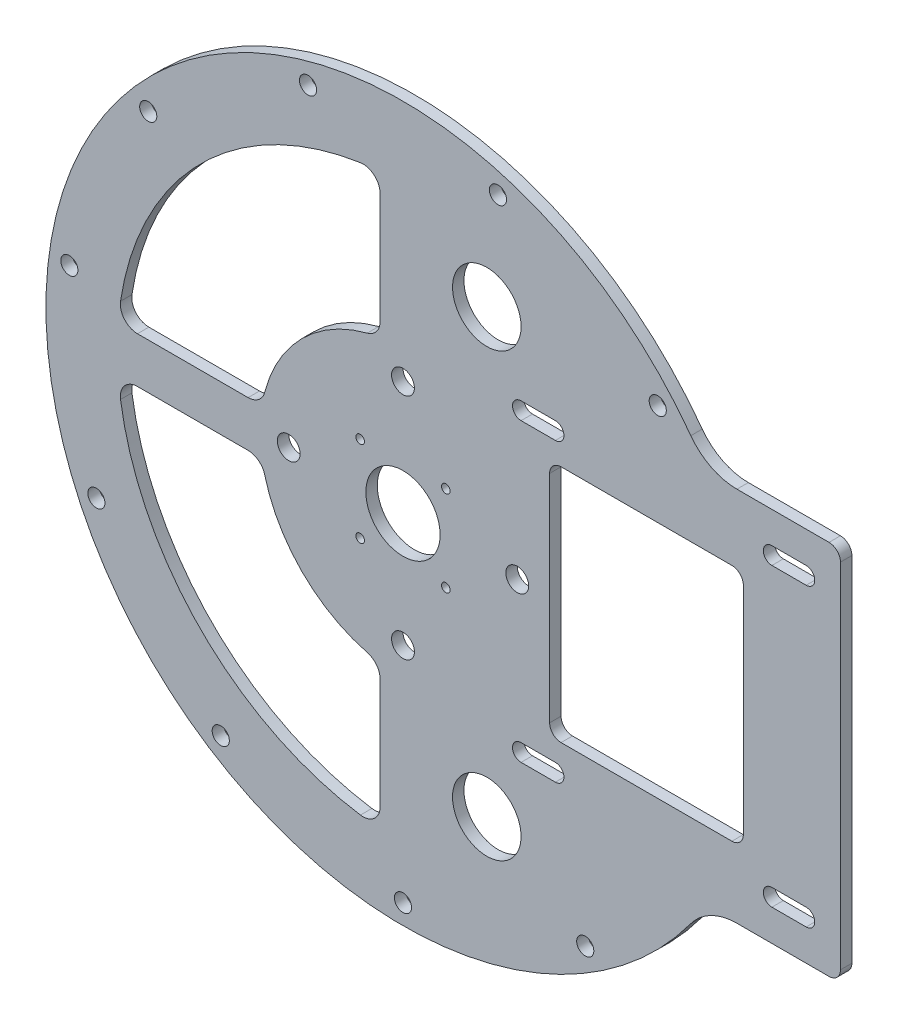
from build123d import *

# Parameters (mm, degrees)
SKETCH_1_R      = 2
SKETCH_1_R_2    = 1.5
SKETCH_1_R_3    = 6.5
SKETCH_1_R_4    = 0.75
SKETCH_1_R_5    = 6
EXTRUDE_1_DEPTH = 2


with BuildPart() as part:
    # 草图1 → 凸台-拉伸1 (new body)
    with BuildSketch(Plane.XY):
        with BuildLine():
            Line((58.445187997, 32.9), (74.5685, 32.9))
            ThreePointArc((74.5685, 32.9), (75.982713562, 32.314213562), (76.5685, 30.9))
            Line((76.5685, 30.9), (76.5685, -30.9))
            ThreePointArc((76.5685, -30.9), (75.982713562, -32.314213562), (74.5685, -32.9))
            Line((74.5685, -32.9), (58.445187997, -32.9))
            ThreePointArc((58.445187997, -32.9), (53.927025417, -33.978889817), (50.383782756, -36.982758621))
            ThreePointArc((50.383782756, -36.982758621), (-62.5, 0), (50.383782756, 36.982758621))
            ThreePointArc((50.383782756, 36.982758621), (53.927025417, 33.978889817), (58.445187997, 32.9))
        make_face()
        with Locations((0, -20)):
            Circle(SKETCH_1_R, mode=Mode.SUBTRACT)
        with Locations((0, -59)):
            Circle(SKETCH_1_R_2, mode=Mode.SUBTRACT)
        with Locations((-20, 0)):
            Circle(SKETCH_1_R, mode=Mode.SUBTRACT)
        with Locations((0, 20)):
            Circle(SKETCH_1_R, mode=Mode.SUBTRACT)
        with Locations((20, 0)):
            Circle(SKETCH_1_R, mode=Mode.SUBTRACT)
        with Locations((-31.89780823, -49.633958437)):
            Circle(SKETCH_1_R_2, mode=Mode.SUBTRACT)
        with Locations((-53.668287726, -24.509485767)):
            Circle(SKETCH_1_R_2, mode=Mode.SUBTRACT)
        with Locations((-58.399465071, 8.396575458)):
            Circle(SKETCH_1_R_2, mode=Mode.SUBTRACT)
        with Locations((-44.589224887, 38.636783303)):
            Circle(SKETCH_1_R_2, mode=Mode.SUBTRACT)
        with Locations((-16.622220854, 56.610085443)):
            Circle(SKETCH_1_R_2, mode=Mode.SUBTRACT)
        with Locations((16.622220854, 56.610085443)):
            Circle(SKETCH_1_R_2, mode=Mode.SUBTRACT)
        with Locations((44.589224887, 38.636783303)):
            Circle(SKETCH_1_R_2, mode=Mode.SUBTRACT)
        with Locations((31.89780823, -49.633958437)):
            Circle(SKETCH_1_R_2, mode=Mode.SUBTRACT)
        Circle(SKETCH_1_R_3, mode=Mode.SUBTRACT)
        with Locations((-7.498513861, -7.498513861)):
            Circle(SKETCH_1_R_4, mode=Mode.SUBTRACT)
        with Locations((-7.498513861, 7.498513861)):
            Circle(SKETCH_1_R_4, mode=Mode.SUBTRACT)
        with Locations((7.498513861, 7.498513861)):
            Circle(SKETCH_1_R_4, mode=Mode.SUBTRACT)
        with Locations((7.498513861, -7.498513861)):
            Circle(SKETCH_1_R_4, mode=Mode.SUBTRACT)
        with Locations((14.6685, 38.636783303)):
            Circle(SKETCH_1_R_5, mode=Mode.SUBTRACT)
        with Locations(Location((14.6685, -38.636783303, 0), (0, 0, 180))):
            Circle(SKETCH_1_R_5, mode=Mode.SUBTRACT)
        with BuildLine():
            Line((-46.475800154, 4), (-27.110883423, 4))
            ThreePointArc((-27.110883423, 4), (-25.273766116, 4.628291755), (-24.206145914, 6.25))
            ThreePointArc((-24.206145914, 6.25), (-17.67766953, 17.67766953), (-6.25, 24.206145914))
            ThreePointArc((-6.25, 24.206145914), (-4.628291755, 25.273766116), (-4, 27.110883423))
            Line((-4, 27.110883423), (-4, 46.475800154))
            ThreePointArc((-4, 46.475800154), (-5.043015781, 48.749610341), (-7.446808511, 49.44234059))
            ThreePointArc((-7.446808511, 49.44234059), (-35.355339059, 35.355339059), (-49.44234059, 7.446808511))
            ThreePointArc((-49.44234059, 7.446808511), (-48.749610341, 5.043015781), (-46.475800154, 4))
        make_face(mode=Mode.SUBTRACT)
        with BuildLine():
            Line((-27.110883423, -4), (-46.475800154, -4))
            ThreePointArc((-46.475800154, -4), (-48.749610341, -5.043015781), (-49.44234059, -7.446808511))
            ThreePointArc((-49.44234059, -7.446808511), (-35.355339059, -35.355339059), (-7.446808511, -49.44234059))
            ThreePointArc((-7.446808511, -49.44234059), (-5.043015781, -48.749610341), (-4, -46.475800154))
            Line((-4, -46.475800154), (-4, -27.110883423))
            ThreePointArc((-4, -27.110883423), (-4.628291755, -25.273766116), (-6.25, -24.206145914))
            ThreePointArc((-6.25, -24.206145914), (-17.67766953, -17.67766953), (-24.206145914, -6.25))
            ThreePointArc((-24.206145914, -6.25), (-25.273766116, -4.628291755), (-27.110883423, -4))
        make_face(mode=Mode.SUBTRACT)
        with BuildLine():
            Line((20.6685, -24.4), (26.6685, -24.4))
            ThreePointArc((26.6685, -24.4), (28.1685, -25.9), (26.6685, -27.4))
            Line((26.6685, -27.4), (20.6685, -27.4))
            ThreePointArc((20.6685, -27.4), (19.1685, -25.9), (20.6685, -24.4))
        make_face(mode=Mode.SUBTRACT)
        with BuildLine():
            Line((20.6685, 27.4), (26.6685, 27.4))
            ThreePointArc((26.6685, 27.4), (28.1685, 25.9), (26.6685, 24.4))
            Line((26.6685, 24.4), (20.6685, 24.4))
            ThreePointArc((20.6685, 24.4), (19.1685, 25.9), (20.6685, 27.4))
        make_face(mode=Mode.SUBTRACT)
        with BuildLine():
            Line((64.5685, 27.4), (70.5685, 27.4))
            ThreePointArc((70.5685, 27.4), (72.0685, 25.9), (70.5685, 24.4))
            Line((70.5685, 24.4), (64.5685, 24.4))
            ThreePointArc((64.5685, 24.4), (63.0685, 25.9), (64.5685, 27.4))
        make_face(mode=Mode.SUBTRACT)
        with BuildLine():
            Line((64.5685, -24.4), (70.5685, -24.4))
            ThreePointArc((70.5685, -24.4), (72.0685, -25.9), (70.5685, -27.4))
            Line((70.5685, -27.4), (64.5685, -27.4))
            ThreePointArc((64.5685, -27.4), (63.0685, -25.9), (64.5685, -24.4))
        make_face(mode=Mode.SUBTRACT)
        with BuildLine():
            Line((27.6685, 20.9), (57.5685, 20.9))
            ThreePointArc((57.5685, 20.9), (58.982713562, 20.314213562), (59.5685, 18.9))
            Line((59.5685, 18.9), (59.5685, -18.9))
            ThreePointArc((59.5685, -18.9), (58.982713562, -20.314213562), (57.5685, -20.9))
            Line((57.5685, -20.9), (27.6685, -20.9))
            ThreePointArc((27.6685, -20.9), (26.254286438, -20.314213562), (25.6685, -18.9))
            Line((25.6685, -18.9), (25.6685, 18.9))
            ThreePointArc((25.6685, 18.9), (26.254286438, 20.314213562), (27.6685, 20.9))
        make_face(mode=Mode.SUBTRACT)
    extrude(amount=EXTRUDE_1_DEPTH)


solid = part.part
